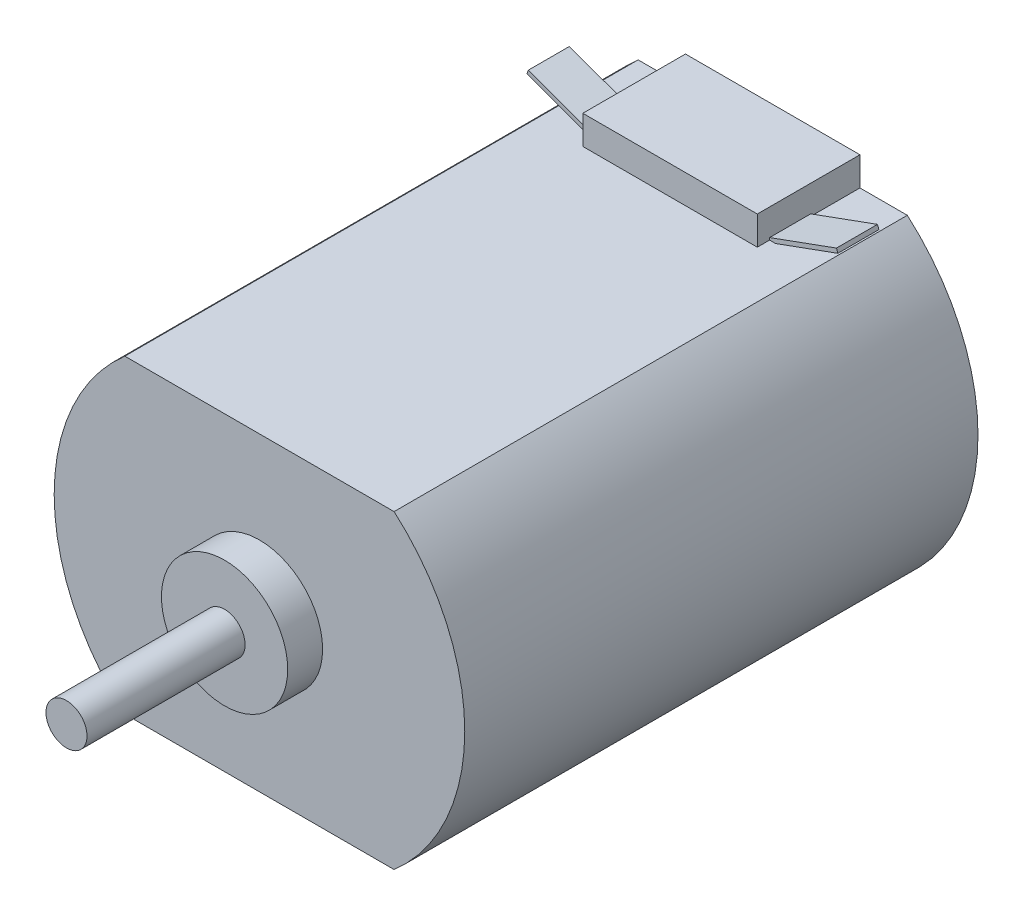
from build123d import *

# Parameters (mm, degrees)
EXTRUDE_1_DEPTH = 25
SKETCH_3_R      = 1
EXTRUDE_2_DEPTH = 9.4
SKETCH_4_R      = 3.075
EXTRUDE_3_DEPTH = 1.7
EXTRUDE_4_DEPTH = 2.3
EXTRUDE_START   = 1.3
SKETCH_6_R      = 1
EXTRUDE_5_DEPTH = 1.3
SKETCH_8_W      = 8.5
SKETCH_8_H      = 5
EXTRUDE_6_DEPTH = 1.4
SKETCH_9_W      = 2
SKETCH_9_H      = 3.5
EXTRUDE_7_DEPTH = 0.1


with BuildPart() as part:
    # 草图2 → 凸台-拉伸1 (new body)
    with BuildSketch(Plane.XY):
        with BuildLine():
            Line((-6.557247898, -7.55), (6.557247898, -7.55))
            ThreePointArc((6.557247898, -7.55), (10, 0), (6.557247898, 7.55))
            Line((6.557247898, 7.55), (-6.557247898, 7.55))
            ThreePointArc((-6.557247898, 7.55), (-10, 0), (-6.557247898, -7.55))
        make_face()
    extrude(amount=EXTRUDE_1_DEPTH)

    # 草图3 → 凸台-拉伸2 (add)
    with BuildSketch(Plane.XY.offset(25)):
        Circle(SKETCH_3_R)
    extrude(amount=EXTRUDE_2_DEPTH)

    # 草图4 → 凸台-拉伸3 (add)
    with BuildSketch(Plane.XY.offset(25)):
        Circle(SKETCH_4_R)
    extrude(amount=EXTRUDE_3_DEPTH)

    # 草图5 → 凸台-拉伸4 (add)
    with BuildSketch(Plane(origin=(0, 0, 0), x_dir=(-1, 0, 0), z_dir=(0, 0, -1))):
        with BuildLine():
            Line((-3.521008378, -3.55), (3.521008378, -3.55))
            ThreePointArc((3.521008378, -3.55), (0, 5), (-3.521008378, -3.55))
        make_face()
    extrude(amount=EXTRUDE_4_DEPTH)

    # 草图6 → 凸台-拉伸5 (add)
    with BuildSketch(Plane(origin=(0, 0, -2.3), x_dir=(-1, 0, 0), z_dir=(0, 0, -1)).offset(EXTRUDE_START)):
        with Locations(Location((0, 0, 0), (0, 0, 180))):
            Circle(SKETCH_6_R)
    extrude(amount=-EXTRUDE_5_DEPTH)

    # 草图8 → 凸台-拉伸6 (add)
    with BuildSketch(Plane(origin=(0, 7.55, 0), x_dir=(1, 0, 0), z_dir=(0, 1, 0))):
        with Locations((0, -2.5)):
            Rectangle(SKETCH_8_W, SKETCH_8_H)
    extrude(amount=EXTRUDE_6_DEPTH)

    # 草图9 → 凸台-拉伸7 (add, symmetric)
    with BuildSketch(Plane(origin=(-1.929367668, 5.300894102, 0), x_dir=(0, 0, -1), z_dir=(-0.34202014332566943, 0.9396926207859081, 0))):
        with Locations((-3.4, -8.32594572)):
            Rectangle(SKETCH_9_W, SKETCH_9_H)
    extrude_7 = extrude(amount=EXTRUDE_7_DEPTH, both=True)

    # 镜向1: 凸台-拉伸7 across plane
    add(extrude_7.mirror(Plane(origin=(0, 0, 0), x_dir=(0, 0, 1), z_dir=(1, 0, 0))))


solid = part.part
